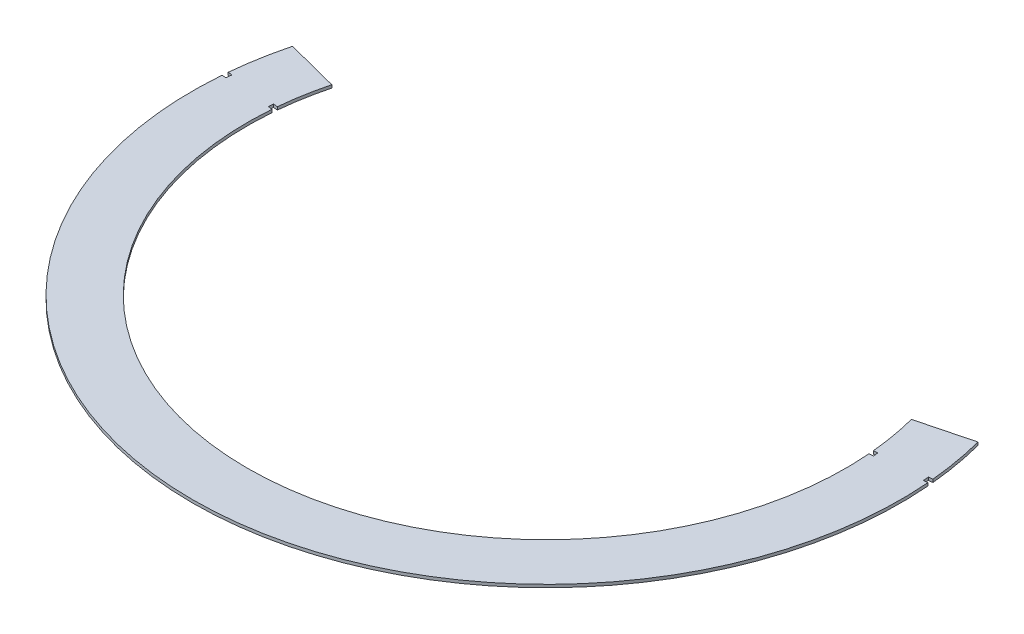
from build123d import *

# Parameters (mm, degrees)
BOSS_EXTRUDE1_DEPTH = 0.35
BOSS_EXTRUDE2_DEPTH = 0.7


with BuildPart() as part:
    # Sketch1 → Boss-Extrude1 (new, symmetric)
    with BuildSketch(Plane(origin=(0, 0, 0), x_dir=(1, 0, 0), z_dir=(0, 1, 0))):
        with BuildLine():
            Line((70.992084628, 5.693181902), (83.950482552, 6.732375453))
            ThreePointArc((83.950482552, 6.732375453), (0, -84.22), (-83.950482552, 6.732375453))
            Line((-83.950482552, 6.732375453), (-70.992084628, 5.693181902))
            ThreePointArc((-70.992084628, 5.693181902), (0, -71.22), (70.992084628, 5.693181902))
        make_face()
    extrude(amount=BOSS_EXTRUDE1_DEPTH, both=True)

    # Sketch2 → Boss-Extrude2 (add)
    with BuildSketch(Plane(origin=(0, 0.35, 0), x_dir=(1, 0, 0), z_dir=(0, 1, 0))):
        with BuildLine():
            Line((71.979704881, 5.772383714), (82.964261813, 6.653285874))
            Line((82.964261813, 6.653285874), (82.836871628, 7.976283525))
            Line((82.836871628, 7.976283525), (83.832267826, 8.072129277))
            ThreePointArc((83.832267826, 8.072129277), (82.940508959, 14.624649523), (81.537394273, 21.087003941))
            Line((81.537394273, 21.087003941), (68.951474948, 17.832063889))
            ThreePointArc((68.951474948, 17.832063889), (70.13800817, 12.367223213), (70.892117248, 6.826134494))
            Line((70.892117248, 6.826134494), (71.887513446, 6.921980247))
            Line((71.887513446, 6.921980247), (71.979704881, 5.772383714))
        make_face()
        with BuildLine():
            Line((-82.964261813, 6.653285874), (-71.979704881, 5.772383714))
            Line((-71.979704881, 5.772383714), (-71.887513446, 6.921980247))
            Line((-71.887513446, 6.921980247), (-70.892117248, 6.826134494))
            ThreePointArc((-70.892117248, 6.826134494), (-70.13800817, 12.367223213), (-68.951474948, 17.832063889))
            Line((-68.951474948, 17.832063889), (-81.537394273, 21.087003941))
            ThreePointArc((-81.537394273, 21.087003941), (-82.940508959, 14.624649523), (-83.832267826, 8.072129277))
            Line((-83.832267826, 8.072129277), (-82.836871628, 7.976283525))
            Line((-82.836871628, 7.976283525), (-82.964261813, 6.653285874))
        make_face()
    extrude(amount=-BOSS_EXTRUDE2_DEPTH)


solid = part.part
